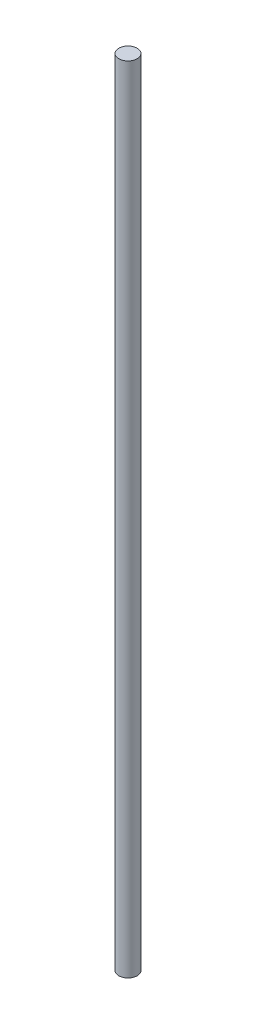
from build123d import *

# Parameters (mm, degrees)
SKETCH1_R           = 3
BOSS_EXTRUDE1_DEPTH = 260


with BuildPart() as part:
    # Sketch1 → Boss-Extrude1 (new body)
    with BuildSketch(Plane(origin=(0, 0, 0), x_dir=(1, 0, 0), z_dir=(0, 1, 0))):
        with Locations(Location((0, 0, 0), (0, 0, 270))):
            Circle(SKETCH1_R)
    extrude(amount=BOSS_EXTRUDE1_DEPTH)


solid = part.part
